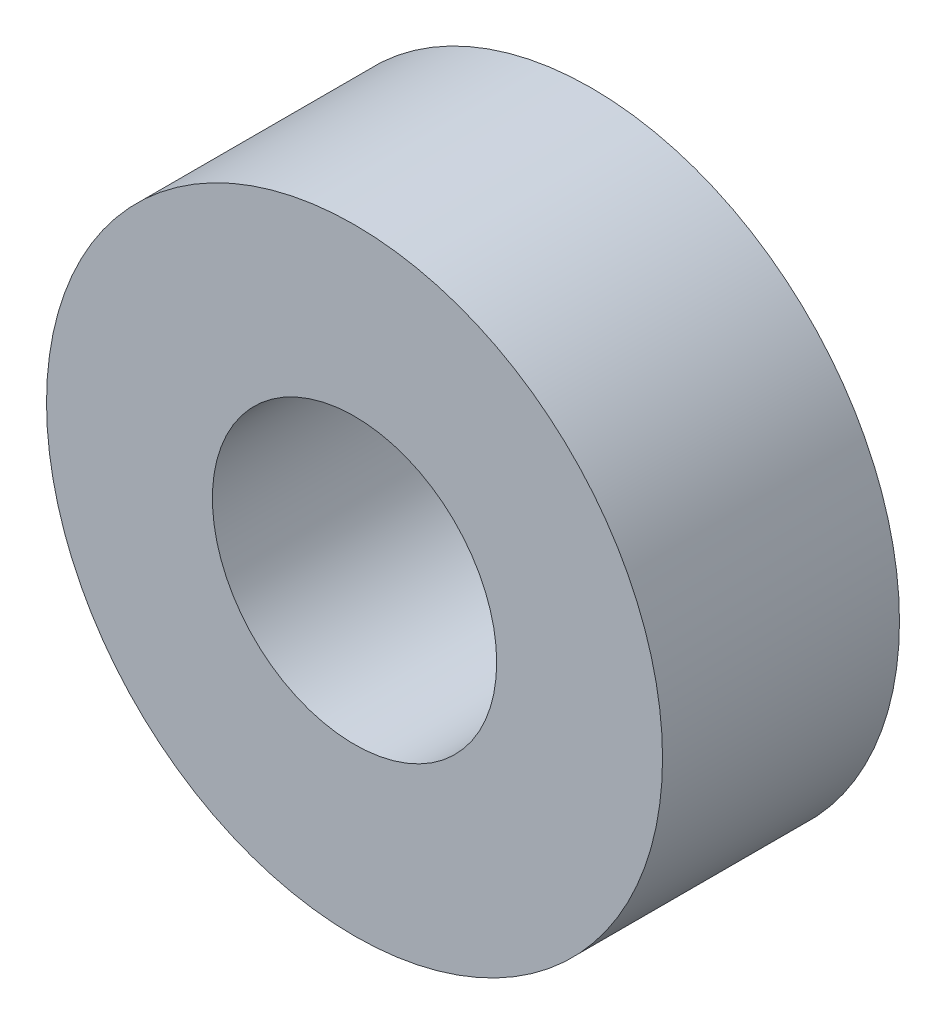
from build123d import *

# Parameters (mm, degrees)
SKETCH_1_R      = 6.5
SKETCH_1_R_2    = 3
EXTRUDE_1_DEPTH = 2.5


with BuildPart() as part:
    # 草图1 → 凸台-拉伸1 (new, symmetric)
    with BuildSketch(Plane.XY):
        Circle(SKETCH_1_R)
        Circle(SKETCH_1_R_2, mode=Mode.SUBTRACT)
    extrude(amount=EXTRUDE_1_DEPTH, both=True)


solid = part.part
